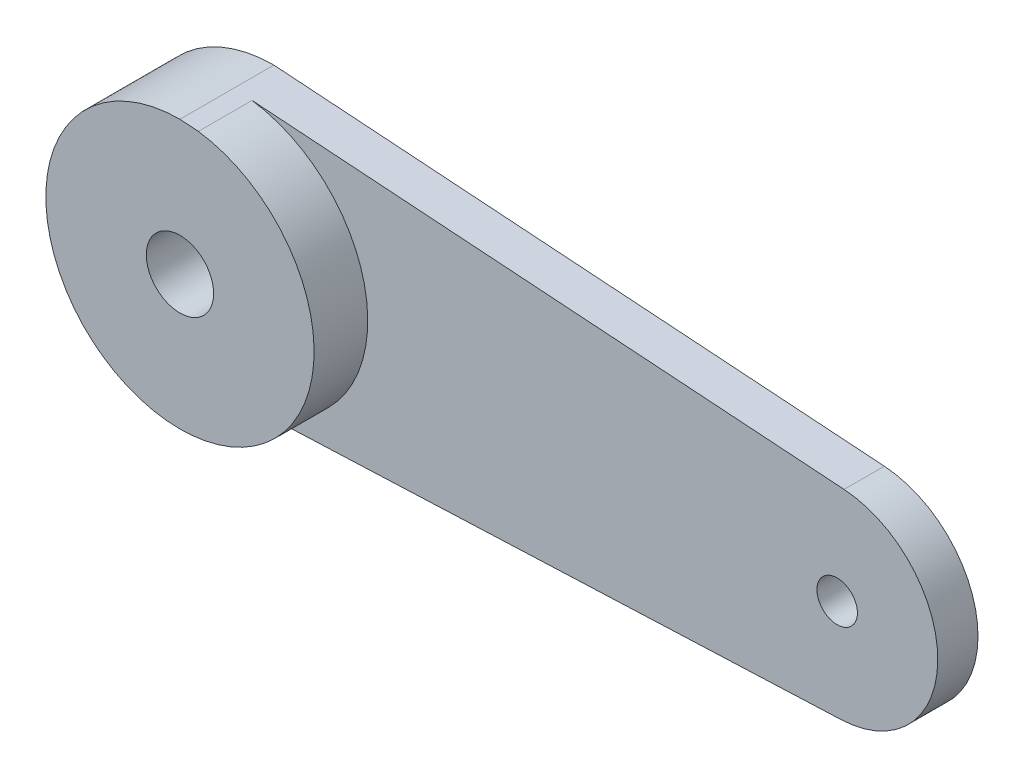
from build123d import *

# Parameters (mm, degrees)
SKETCH1_R           = 2.51
BOSS_EXTRUDE1_DEPTH = 7
SKETCH1_3_R         = 1.51
BOSS_EXTRUDE2_DEPTH = 3


with BuildPart() as part:
    # Sketch1 → Boss-Extrude1 (new body)
    with BuildSketch(Plane.XY):
        with BuildLine():
            Line((1.373905706, 9.905169514), (0, 10))
            ThreePointArc((0, 10), (-10, 0), (0, -10))
            Line((0, -10), (0.829742277, -9.965516934))
            ThreePointArc((0.829742277, -9.965516934), (7.3585808, -6.771357959), (10, 0))
            ThreePointArc((10, 0), (7.541188801, 6.567379346), (1.373905706, 9.905169514))
        make_face()
        Circle(SKETCH1_R, mode=Mode.SUBTRACT)
    extrude(amount=BOSS_EXTRUDE1_DEPTH)

    # Sketch1<3> → Boss-Extrude2 (add)
    with BuildSketch(Plane.XY):
        with BuildLine():
            Line((45.512119929, 6.858637088), (1.373905706, 9.905169514))
            ThreePointArc((1.373905706, 9.905169514), (9.996252352, -0.273749725), (0.829742277, -9.965516934))
            Line((0.829742277, -9.965516934), (45.307101416, -8.117092704))
            ThreePointArc((45.307101416, -8.117092704), (52.49497676, -0.726226835), (45.512119929, 6.858637088))
        make_face()
        with Locations((44.995679477, -0.623561069)):
            Circle(SKETCH1_3_R, mode=Mode.SUBTRACT)
    extrude(amount=BOSS_EXTRUDE2_DEPTH)


solid = part.part
